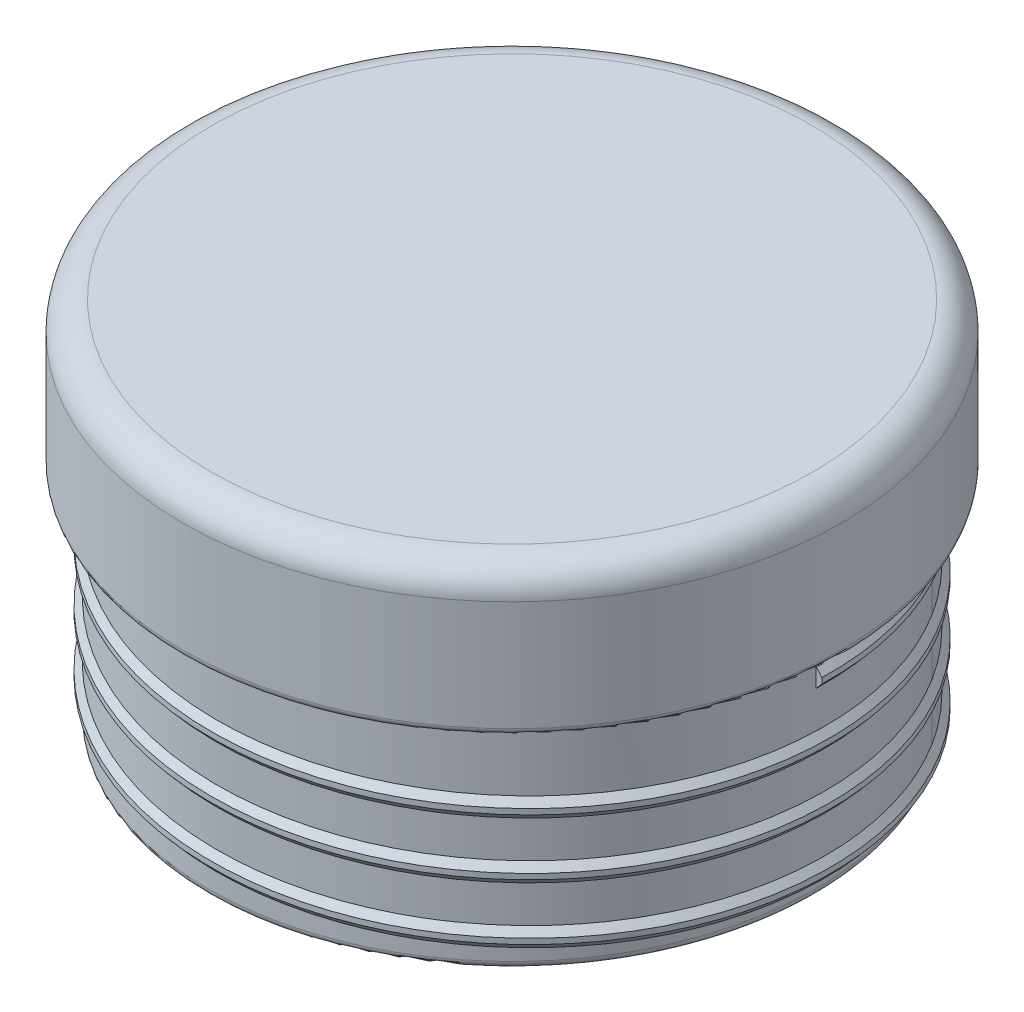
from build123d import *
from OCP.BRepFilletAPI import BRepFilletAPI_MakeFillet

# Parameters (mm, degrees)
SKETCH1_R           = 52.705
BOSS_EXTRUDE1_DEPTH = 38.1
SKETCH3_R           = 57.15
BOSS_EXTRUDE2_DEPTH = 25.4
FILLET1_R1          = 1.27
FILLET1_R2          = 5.08
SWEEP1_PITCH        = 9.736666667
SWEEP1_HEIGHT       = 34.078333333
SWEEP1_RADIUS       = 52.705
SWEEP1_START_ANGLE  = 90


with BuildPart() as part:
    # Sketch1 → Boss-Extrude1 (new body)
    with BuildSketch(Plane(origin=(0, 0, 0), x_dir=(1, 0, 0), z_dir=(0, 1, 0))):
        with Locations(Location((0, 0, 0), (0, 0, 90))):
            Circle(SKETCH1_R)
    extrude(amount=BOSS_EXTRUDE1_DEPTH)

    # Sketch3 → Boss-Extrude2 (add)
    with BuildSketch(Plane(origin=(0, 38.1, 0), x_dir=(1, 0, 0), z_dir=(0, 1, 0))):
        with Locations(Location((0, 0, 0), (0, 0, 270))):
            Circle(SKETCH3_R)
    extrude(amount=BOSS_EXTRUDE2_DEPTH)

    # Fillet1: one fillet with a radius per group of edges: ONE call of the kernel's fillet builder (fillet() takes one radius for all edges)
    fillet1_edges_1 = [part.edges().sort_by_distance(p)[0] for p in [
        (0, 38.1, 52.705),
        (0, 0, 52.705),
        (0, 38.1, -57.15),
    ]]
    fillet1_edges_2 = [part.edges().sort_by_distance(p)[0] for p in [
        (0, 63.5, -57.15),
    ]]
    fillet1 = BRepFilletAPI_MakeFillet(part.part.solid().wrapped)
    for e in fillet1_edges_1:
        fillet1.Add(FILLET1_R1, e.wrapped)
    for e in fillet1_edges_2:
        fillet1.Add(FILLET1_R2, e.wrapped)
    add(Compound.cast(fillet1.Shape()), mode=Mode.REPLACE)

    # Sweep1: sweep along a helix
    with BuildLine() as sweep1_path:
        add(Helix(SWEEP1_PITCH, SWEEP1_HEIGHT, SWEEP1_RADIUS, center=(0, 33.02, 0), direction=(0, -1, 0), lefthand=True, mode=Mode.PRIVATE).rotate(Axis((0, 33.02, 0), (0, -1, 0)), SWEEP1_START_ANGLE))
    # Sketch4 → Sweep1 (sweep)
    with BuildSketch(Plane.XY):
        Polygon((52.451, 34.976627382), (53.721, 33.494960715), (53.721, 32.545039285), (52.451, 31.063372618), align=None)
    sweep(path=sweep1_path.line, is_frenet=True)


solid = part.part
